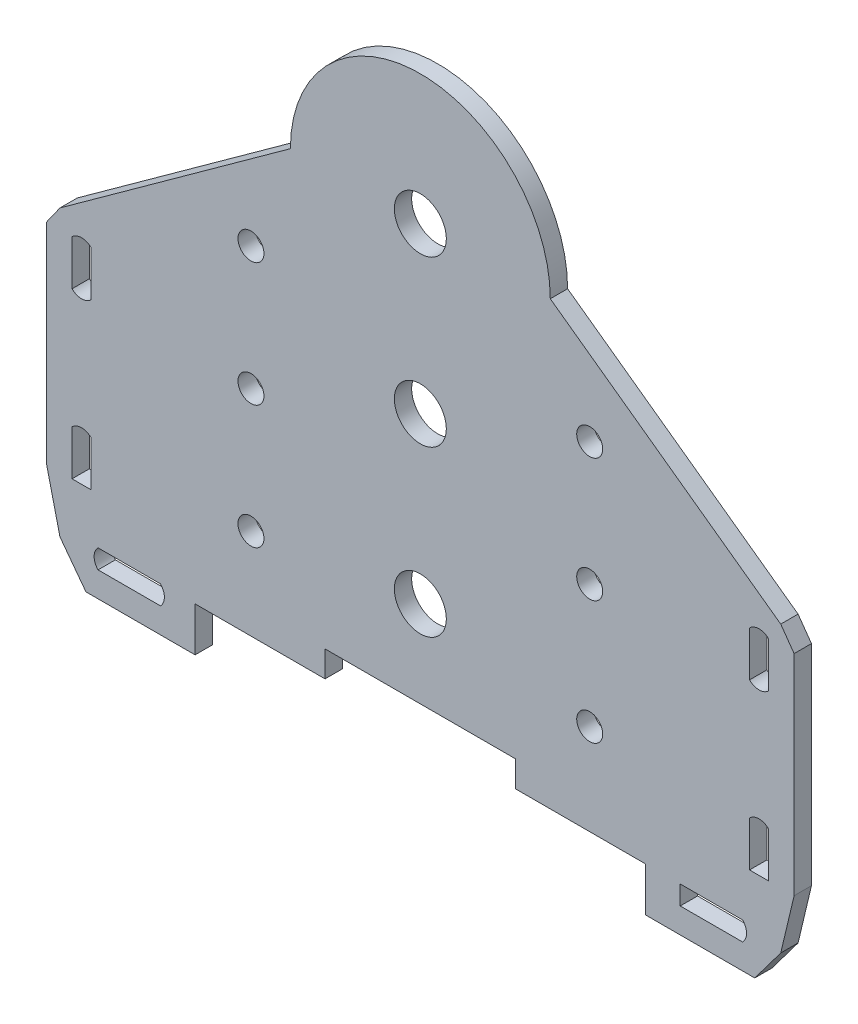
from build123d import *

# Parameters (mm, degrees)
SKETCH_1_R      = 1.5
SKETCH_1_R_2    = 3
EXTRUDE_1_DEPTH = 2


with BuildPart() as part:
    # 草图1 → 凸台-拉伸1 (new body)
    with BuildSketch(Plane.XY):
        with BuildLine():
            Line((-38.6, -4), (-33.6, -4))
            Line((-33.6, -4), (-26, -4))
            Line((-26, -4), (-26, 1.1))
            Line((-26, 1.1), (-11, 1.1))
            Line((-11, 1.1), (-11, 4.1))
            Line((-11, 4.1), (11, 4.1))
            Line((11, 4.1), (11, 1.1))
            Line((11, 1.1), (26, 1.1))
            Line((26, 1.1), (26, -4))
            Line((26, -4), (33.6, -4))
            Line((33.6, -4), (38.6, -4))
            Line((38.6, -4), (41.6, 0))
            Line((41.6, 0), (43.145657482, 6.5))
            Line((43.145657482, 6.5), (43.145657482, 30.7))
            Line((43.145657482, 30.7), (41.6, 32.877506789))
            Line((41.6, 32.877506789), (15, 52.1))
            ThreePointArc((15, 52.1), (0, 67.1), (-15, 52.1))
            Line((-15, 52.1), (-41.6, 32.877506789))
            Line((-41.6, 32.877506789), (-43.145657482, 30.7))
            Line((-43.145657482, 30.7), (-43.145657482, 6.5))
            Line((-43.145657482, 6.5), (-41.6, 0))
            Line((-41.6, 0), (-38.6, -4))
        make_face()
        with BuildLine():
            Line((-30, -1.1), (-37.2, -1.1))
            ThreePointArc((-37.2, -1.1), (-37.655634919, 0), (-37.2, 1.1))
            Line((-37.2, 1.1), (-30, 1.1))
            ThreePointArc((-30, 1.1), (-29.544365081, 0), (-30, -1.1))
        make_face(mode=Mode.SUBTRACT)
        with BuildLine():
            Line((-40.2, 6.5), (-40.2, 11.7))
            ThreePointArc((-40.2, 11.7), (-39.1, 12.155634919), (-38, 11.7))
            Line((-38, 11.7), (-38, 6.5))
            Line((-38, 6.5), (-40.2, 6.5))
        make_face(mode=Mode.SUBTRACT)
        with Locations((-19.55, 11.6)):
            Circle(SKETCH_1_R, mode=Mode.SUBTRACT)
        with BuildLine():
            Line((-38, 30.7), (-38, 25.5))
            ThreePointArc((-38, 25.5), (-39.1, 25.044365081), (-40.2, 25.5))
            Line((-40.2, 25.5), (-40.2, 30.7))
            ThreePointArc((-40.2, 30.7), (-39.1, 31.155634919), (-38, 30.7))
        make_face(mode=Mode.SUBTRACT)
        with Locations((-19.55, 25.85)):
            Circle(SKETCH_1_R, mode=Mode.SUBTRACT)
        with Locations((19.55, 11.6)):
            Circle(SKETCH_1_R, mode=Mode.SUBTRACT)
        with BuildLine():
            Line((30, 1.1), (37.2, 1.1))
            ThreePointArc((37.2, 1.1), (37.655634919, 0), (37.2, -1.1))
            Line((37.2, -1.1), (30, -1.1))
            Line((30, -1.1), (30, 1.1))
        make_face(mode=Mode.SUBTRACT)
        with BuildLine():
            Line((38, 6.5), (38, 11.7))
            ThreePointArc((38, 11.7), (39.1, 12.155634919), (40.2, 11.7))
            Line((40.2, 11.7), (40.2, 6.5))
            Line((40.2, 6.5), (38, 6.5))
        make_face(mode=Mode.SUBTRACT)
        with Locations((0, 14.1)):
            Circle(SKETCH_1_R_2, mode=Mode.SUBTRACT)
        with Locations((19.55, 25.85)):
            Circle(SKETCH_1_R, mode=Mode.SUBTRACT)
        with BuildLine():
            Line((40.2, 30.7), (40.2, 25.5))
            ThreePointArc((40.2, 25.5), (39.1, 25.044365081), (38, 25.5))
            Line((38, 25.5), (38, 30.7))
            ThreePointArc((38, 30.7), (39.1, 31.155634919), (40.2, 30.7))
        make_face(mode=Mode.SUBTRACT)
        with Locations((-19.55, 40.1)):
            Circle(SKETCH_1_R, mode=Mode.SUBTRACT)
        with Locations((0, 33.1)):
            Circle(SKETCH_1_R_2, mode=Mode.SUBTRACT)
        with Locations((0, 52.1)):
            Circle(SKETCH_1_R_2, mode=Mode.SUBTRACT)
        with Locations((19.55, 40.1)):
            Circle(SKETCH_1_R, mode=Mode.SUBTRACT)
    extrude(amount=EXTRUDE_1_DEPTH)


solid = part.part
